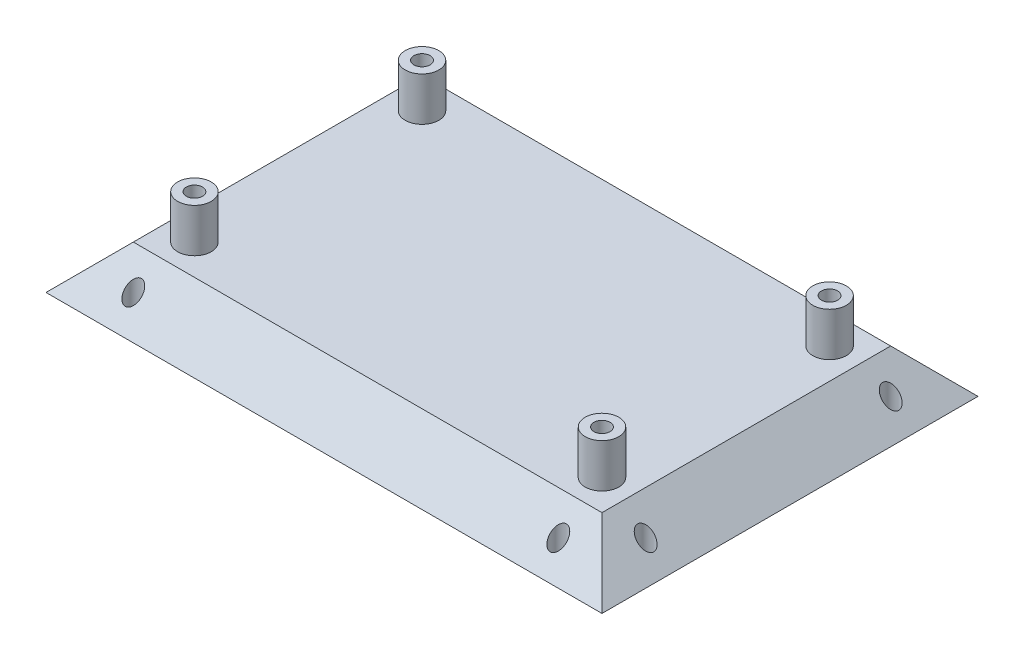
from build123d import *

# Parameters (mm, degrees)
SKETCH3_R           = 1.85
CUT_EXTRUDE1_DEPTH  = 155.06371723
SKETCH4_R           = 3.85
SKETCH4_R_2         = 1.85
BOSS_EXTRUDE1_DEPTH = 10


with BuildPart() as part:
    # Sketch1 → Loft1 section 0
    with BuildSketch(Plane(origin=(0, 0, 0), x_dir=(1, 0, 0), z_dir=(0, 1, 0))):
        with BuildLine():
            Line((0, 0), (127.35007717, 0))
            Line((127.35007717, 0), (127.35007717, -86.125413014))
            Line((127.35007717, -86.125413014), (0, -86.125413014))
            Line((0, -86.125413014), (0, 0))
        make_face()
    # Sketch2 → Loft1 section 1
    with BuildSketch(Plane(origin=(0, 10, 0), x_dir=(1, 0, 0), z_dir=(0, 1, 0))):
        with BuildLine():
            Line((10, -10), (10, -76.125413014))
            Line((10, -76.125413014), (117.35007717, -76.125413014))
            Line((117.35007717, -76.125413014), (117.35007717, -10))
            Line((117.35007717, -10), (10, -10))
        make_face()
    loft()

    # Sketch3 → Cut-Extrude1 (cut, through all)
    with BuildSketch(Plane.XZ):
        with Locations(Location((5, 15, 0), (0, 0, 270))):
            Circle(SKETCH3_R)
        with Locations(Location((5, 71.125413014, 0), (0, 0, 180))):
            Circle(SKETCH3_R)
        with Locations(Location((122.35007717, 71.125413014, 0), (0, 0, 270))):
            Circle(SKETCH3_R)
        with Locations((122.35007717, 15)):
            Circle(SKETCH3_R)
        with Locations(Location((15, 5, 0), (0, 0, 270))):
            Circle(SKETCH3_R)
        with Locations(Location((15, 81.125413014, 0), (0, 0, 270))):
            Circle(SKETCH3_R)
        with Locations(Location((112.35007717, 81.125413014, 0), (0, 0, 90))):
            Circle(SKETCH3_R)
        with Locations(Location((112.35007717, 5, 0), (0, 0, 270))):
            Circle(SKETCH3_R)
    extrude(amount=-CUT_EXTRUDE1_DEPTH, mode=Mode.SUBTRACT)

    # Sketch4 → Boss-Extrude1 (add)
    # profile 1 of 4: a face of its own
    with BuildSketch(Plane(origin=(0, 10, 0), x_dir=(1, 0, 0), z_dir=(0, 1, 0))):
        with Locations(Location((110.35007717, -69.125413014, 0), (0, 0, 270))):
            Circle(SKETCH4_R)
        with Locations(Location((110.35007717, -69.125413014, 0), (0, 0, 270))):
            Circle(SKETCH4_R_2, mode=Mode.SUBTRACT)
    # profile 2 of 4: a face of its own
    with BuildSketch(Plane(origin=(0, 10, 0), x_dir=(1, 0, 0), z_dir=(0, 1, 0))):
        with Locations(Location((110.35007717, -17, 0), (0, 0, 90))):
            Circle(SKETCH4_R)
        with Locations(Location((110.35007717, -17, 0), (0, 0, 90))):
            Circle(SKETCH4_R_2, mode=Mode.SUBTRACT)
    # profile 3 of 4: a face of its own
    with BuildSketch(Plane(origin=(0, 10, 0), x_dir=(1, 0, 0), z_dir=(0, 1, 0))):
        with Locations(Location((17, -17, 0), (0, 0, 270))):
            Circle(SKETCH4_R)
        with Locations(Location((17, -17, 0), (0, 0, 270))):
            Circle(SKETCH4_R_2, mode=Mode.SUBTRACT)
    # profile 4 of 4: a face of its own
    with BuildSketch(Plane(origin=(0, 10, 0), x_dir=(1, 0, 0), z_dir=(0, 1, 0))):
        with Locations(Location((17, -69.125413014, 0), (0, 0, 90))):
            Circle(SKETCH4_R)
        with Locations(Location((17, -69.125413014, 0), (0, 0, 90))):
            Circle(SKETCH4_R_2, mode=Mode.SUBTRACT)
    extrude(amount=BOSS_EXTRUDE1_DEPTH)


solid = part.part
